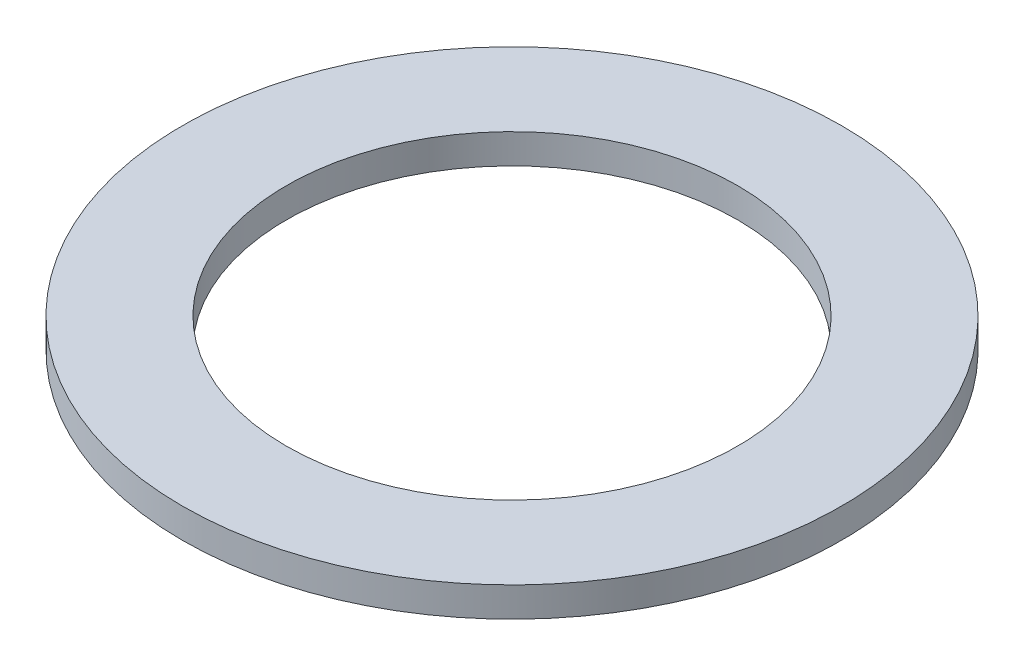
from build123d import *

# Parameters (mm, degrees)
SKETCH1_W = 3.5
SKETCH1_H = 1


with BuildPart() as part:
    # Sketch1 → Revolve1 (revolve)
    with BuildSketch(Plane.XY, mode=Mode.PRIVATE) as revolve1_sk:
        with Locations((-9.35, 0.5)):
            Rectangle(SKETCH1_W, SKETCH1_H)
    revolve(revolve1_sk.sketch.rotate(Axis((0, 0, 0), (0, 1, 0)), 270), axis=Axis((0, 0, 0), (0, 1, 0)))


solid = part.part
